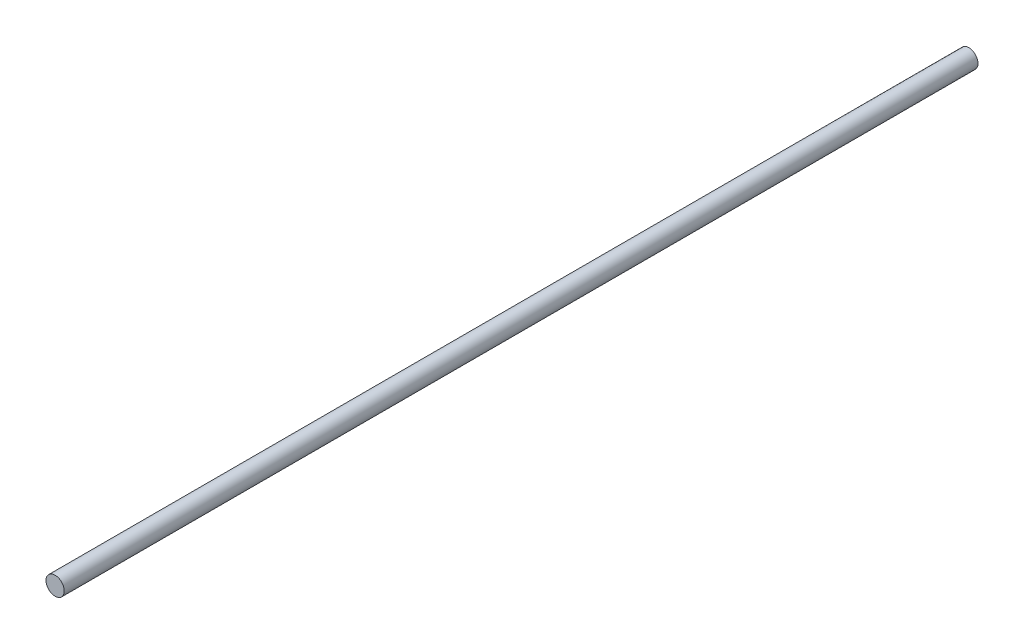
from build123d import *

# Parameters (mm, degrees)
IZIM1_R                     = 4
Y_KSEKLIK_EKSTR_ZYON1_DEPTH = 400


with BuildPart() as part:
    # Çizim1 → Yükseklik-Ekstrüzyon1 (new body)
    with BuildSketch(Plane.XY):
        Circle(IZIM1_R)
    extrude(amount=Y_KSEKLIK_EKSTR_ZYON1_DEPTH)


solid = part.part
